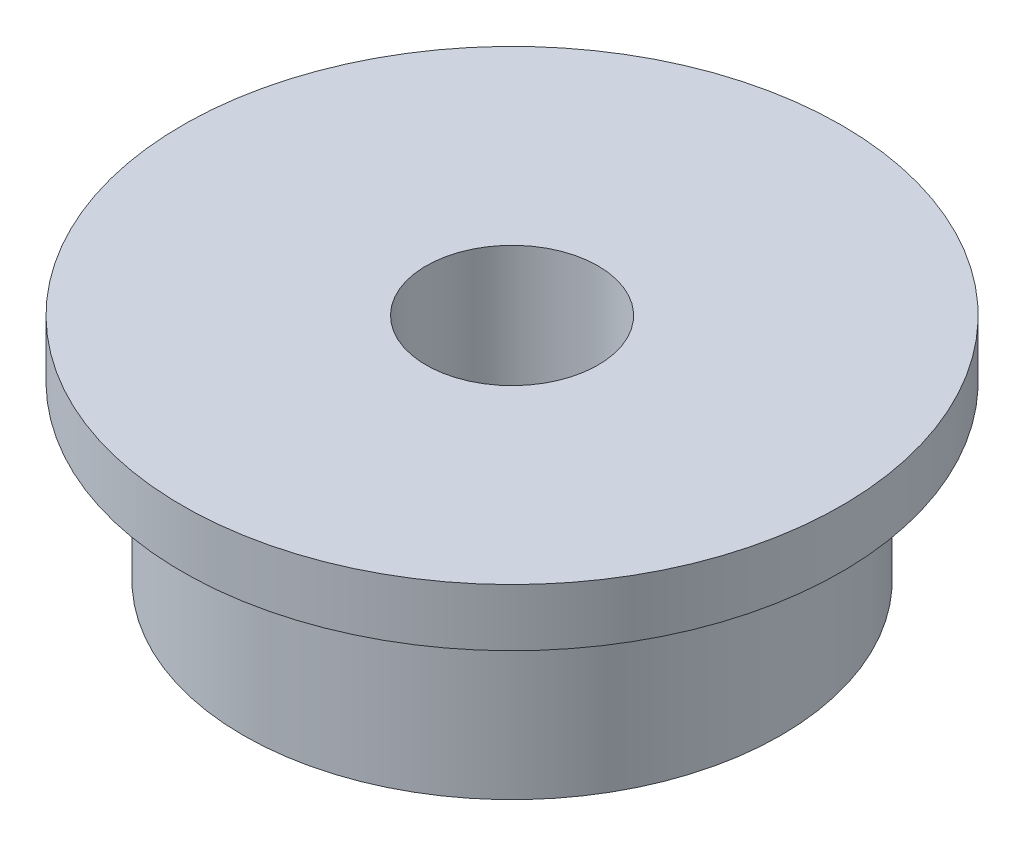
from build123d import *


with BuildPart() as part:
    # Sketch1 → Revolve1 (revolve)
    with BuildSketch(Plane.XY, mode=Mode.PRIVATE) as revolve1_sk:
        Polygon((-1.5, 0.543442623), (-1.5, 4.543442623), (-5.75, 4.543442623), (-5.75, 3.543442623), (-4.69, 3.543442623), (-4.69, 0.543442623), align=None)
    revolve(revolve1_sk.sketch.rotate(Axis((0, 0, 0), (0, 1, 0)), 270), axis=Axis((0, 0, 0), (0, 1, 0)))


solid = part.part
